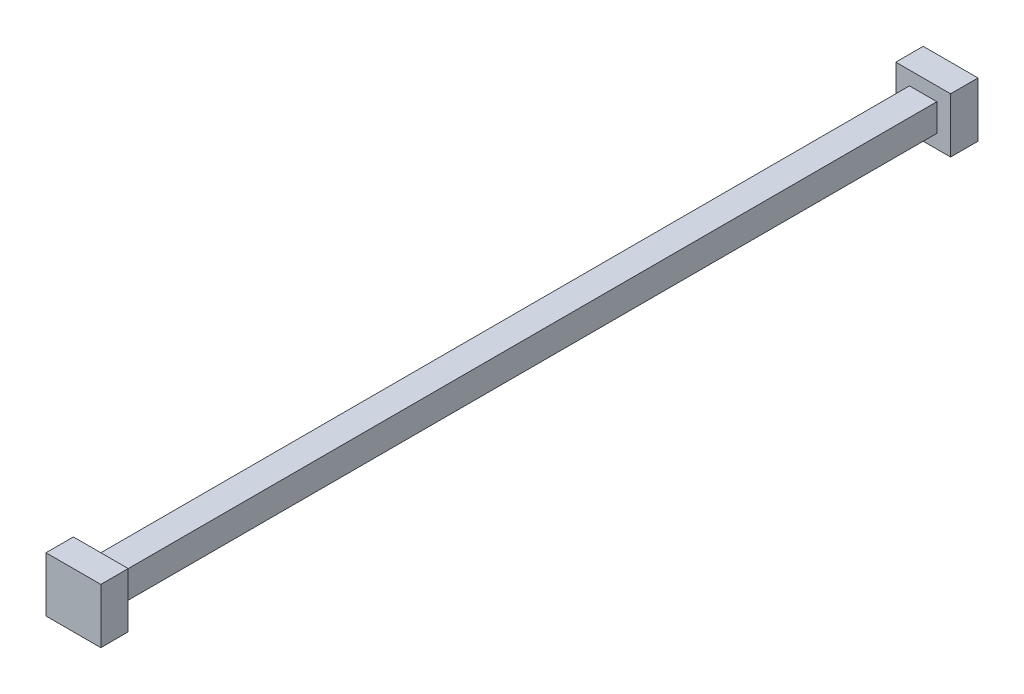
from build123d import *

# Parameters (mm, degrees)
SKETCH_1_W      = 10
SKETCH_1_H      = 10
EXTRUDE_1_DEPTH = 300
SKETCH_2_W      = 20
SKETCH_2_H      = 20
EXTRUDE_2_DEPTH = 10
SKETCH_3_W      = 20
SKETCH_3_H      = 20
EXTRUDE_3_DEPTH = 10


with BuildPart() as part:
    # 草图1 → 凸台-拉伸1 (new body)
    with BuildSketch(Plane.XY):
        Rectangle(SKETCH_1_W, SKETCH_1_H)
    extrude(amount=EXTRUDE_1_DEPTH)

    # 草图2 → 凸台-拉伸2 (add)
    with BuildSketch(Plane.XY.offset(300)):
        Rectangle(SKETCH_2_W, SKETCH_2_H)
    extrude(amount=EXTRUDE_2_DEPTH)

    # 草图3 → 凸台-拉伸3 (add)
    with BuildSketch(Plane(origin=(0, 0, 0), x_dir=(-1, 0, 0), z_dir=(0, 0, -1))):
        Rectangle(SKETCH_3_W, SKETCH_3_H)
    extrude(amount=EXTRUDE_3_DEPTH)


solid = part.part
